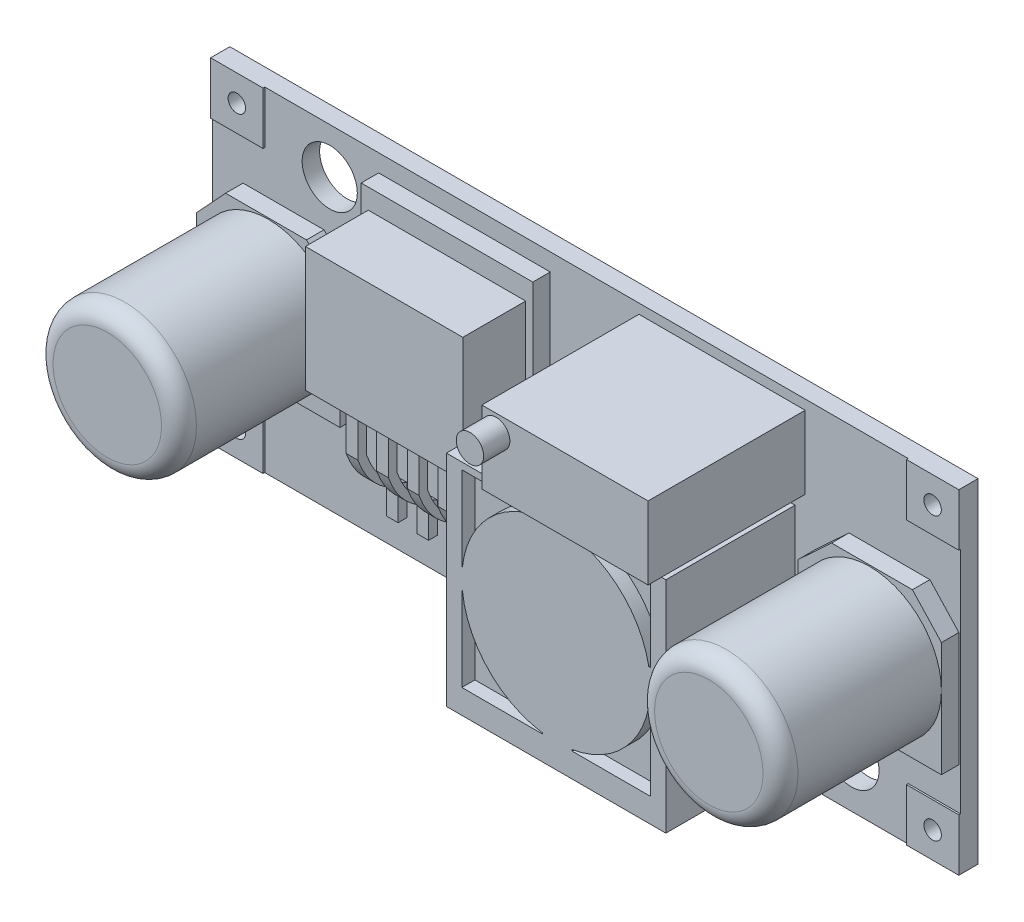
from build123d import *

# Parameters (mm, degrees)
SKETCH1_W           = 42.852737666
SKETCH1_H           = 19.127379028
SKETCH1_R           = 1.58
BOSS_EXTRUDE1_DEPTH = 1
SKETCH2_W           = 3
SKETCH2_H           = 3
BOSS_EXTRUDE2_DEPTH = 0.1
SKETCH3_R           = 0.5
CUT_EXTRUDE1_DEPTH  = 5
BOSS_EXTRUDE3_DEPTH = 1
SKETCH5_R           = 4.105
BOSS_EXTRUDE4_DEPTH = 9.22
FILLET1_R           = 1
FILLET2_R           = 1
SKETCH6_W           = 9.83
SKETCH6_H           = 8.75
BOSS_EXTRUDE5_DEPTH = 4.6
SKETCH7_W           = 9.83
SKETCH7_H           = 8.75
SKETCH7_W_2         = 9.014866003
SKETCH7_H_2         = 7.13033049
CUT_EXTRUDE2_DEPTH  = 3.6
SKETCH8_W           = 0.671327252
SKETCH8_H           = 3.75
BOSS_EXTRUDE6_DEPTH = 8
CUT_EXTRUDE3_DEPTH  = 9
SKETCH10_W          = 12.57
SKETCH10_H          = 12.57
BOSS_EXTRUDE7_DEPTH = 7.4
CUT_EXTRUDE7_DEPTH  = 0.75
SKETCH13_W          = 9.52
SKETCH13_H          = 4.17
BOSS_EXTRUDE8_DEPTH = 9
SKETCH14_R          = 0.785768403
BOSS_EXTRUDE9_DEPTH = 1.5


with BuildPart() as part:
    # Sketch1 → Boss-Extrude1 (new body)
    with BuildSketch(Plane.XY):
        Rectangle(SKETCH1_W, SKETCH1_H)
        with Locations((-14.706368833, 6.953689514)):
            Circle(SKETCH1_R, mode=Mode.SUBTRACT)
        with Locations((15.176368833, -6.773993326)):
            Circle(SKETCH1_R, mode=Mode.SUBTRACT)
    extrude(amount=BOSS_EXTRUDE1_DEPTH)

    # Sketch2 → Boss-Extrude2 (add)
    with BuildSketch(Plane.XY.offset(1)):
        with Locations((-19.926368833, 8.063689514)):
            Rectangle(SKETCH2_W, SKETCH2_H)
        with Locations((-19.926368833, -8.063689514)):
            Rectangle(SKETCH2_W, SKETCH2_H)
        with Locations((19.926368833, -8.063689514)):
            Rectangle(SKETCH2_W, SKETCH2_H)
        with Locations((19.926368833, 8.063689514)):
            Rectangle(SKETCH2_W, SKETCH2_H)
    extrude(amount=BOSS_EXTRUDE2_DEPTH)

    # Sketch3 → Cut-Extrude1 (cut)
    with BuildSketch(Plane.XY.offset(1.1)):
        with Locations((-19.926368833, 8.063689514)):
            Circle(SKETCH3_R)
        with Locations((-19.926368833, -8.063689514)):
            Circle(SKETCH3_R)
        with Locations((19.926368833, -8.063689514)):
            Circle(SKETCH3_R)
        with Locations((19.926368833, 8.063689514)):
            Circle(SKETCH3_R)
    extrude(amount=-CUT_EXTRUDE1_DEPTH, mode=Mode.SUBTRACT)

    # Sketch4 → Boss-Extrude3 (add)
    with BuildSketch(Plane.XY.offset(1)):
        Polygon((-15.037755442, 4.175), (-13.121368833, 2.397984661), (-13.121368833, -4.175), (-21.331368833, -4.175), (-21.331368833, 2.383236744), (-19.66991348, 4.175), align=None)
        Polygon((21.331368833, -4.175), (21.331368833, 2.383236744), (19.66991348, 4.175), (15.037755442, 4.175), (13.121368833, 2.397984661), (13.121368833, -4.175), align=None)
    extrude(amount=BOSS_EXTRUDE3_DEPTH)

    # Sketch5 → Boss-Extrude4 (add)
    with BuildSketch(Plane.XY.offset(2)):
        with Locations((-17.226368833, 0)):
            Circle(SKETCH5_R)
        with Locations(Location((17.226368833, 0, 0), (0, 0, 180))):
            Circle(SKETCH5_R)
    extrude(amount=BOSS_EXTRUDE4_DEPTH)

    # Fillet1
    fillet1_edges = [part.edges().sort_by_distance(p)[0] for p in [
        (-21.331368833, 0, 11.22),
    ]]
    fillet(fillet1_edges, radius=FILLET1_R)

    # Fillet2
    fillet2_edges = [part.edges().sort_by_distance(p)[0] for p in [
        (21.331368833, 0, 11.22),
    ]]
    fillet(fillet2_edges, radius=FILLET2_R)

    # Sketch6 → Boss-Extrude5 (add)
    with BuildSketch(Plane.XY.offset(1)):
        with Locations((-6.991368833, 4.188689514)):
            Rectangle(SKETCH6_W, SKETCH6_H)
    extrude(amount=BOSS_EXTRUDE5_DEPTH)

    # Sketch7 → Cut-Extrude2 (cut)
    with BuildSketch(Plane.XY.offset(5.6)):
        with Locations((-6.991368833, 4.188689514)):
            Rectangle(SKETCH7_W, SKETCH7_H)
        with Locations((-6.991368834, 3.853025888)):
            Rectangle(SKETCH7_W_2, SKETCH7_H_2, mode=Mode.SUBTRACT)
    extrude(amount=-CUT_EXTRUDE2_DEPTH, mode=Mode.SUBTRACT)

    # Sketch8 → Boss-Extrude6 (add)
    with BuildSketch(Plane(origin=(0, 0.287860643, 0), x_dir=(-1, 0, 0), z_dir=(0, -1, 0))):
        with Locations((8.85699558, -2.895840935)):
            Rectangle(SKETCH8_W, SKETCH8_H)
        with Locations((10.60699558, -2.895840935)):
            Rectangle(SKETCH8_W, SKETCH8_H)
        with Locations((7.10699558, -2.895840935)):
            Rectangle(SKETCH8_W, SKETCH8_H)
        with Locations((5.35699558, -2.895840935)):
            Rectangle(SKETCH8_W, SKETCH8_H)
        with Locations((3.60699558, -2.895840935)):
            Rectangle(SKETCH8_W, SKETCH8_H)
    extrude(amount=BOSS_EXTRUDE6_DEPTH)

    # Sketch9 → Cut-Extrude3 (cut)
    with BuildSketch(Plane(origin=(-3.271331954, 0, 0), x_dir=(0, 0, -1), z_dir=(1, 0, 0))):
        with BuildLine():
            Line((-3.820845945, -3.459233043), (-3.820845945, 0.287860643))
            Line((-3.820845945, 0.287860643), (-4.770840935, 0.287860643))
            Line((-4.770840935, 0.287860643), (-4.770840935, -7.712139357))
            Line((-4.770840935, -7.712139357), (-2, -7.712139357))
            Line((-2, -7.712139357), (-1.520840935, -7.712139357))
            Line((-1.520840935, -7.712139357), (-1.520840935, -5.954433266))
            add(Edge.make_bspline(
                [(-3.820845945, -3.459233043), (-3.201230597, -5.246051494), (-1.520840935, -5.954433266)],
                knots=[0, 0, 0, 1, 1, 1], degree=2))
        make_face()
        with BuildLine():
            Line((-2, 0.287860643), (-3.320845945, 0.287860643))
            Line((-3.320845945, 0.287860643), (-3.320845945, -3.459233043))
            add(Edge.make_bspline(
                [(-3.320845945, -3.459233043), (-2.701230597, -5.246051494), (-1.020840935, -5.954433266)],
                knots=[0, 0, 0, 1, 1, 1], degree=2))
            Line((-1.020840935, -5.954433266), (-1.020840935, -0.186310486))
            Line((-1.020840935, -0.186310486), (-2, -0.186310486))
            Line((-2, -0.186310486), (-2, 0.287860643))
        make_face()
    extrude(amount=-CUT_EXTRUDE3_DEPTH, mode=Mode.SUBTRACT)

    # Sketch10 → Boss-Extrude7 (add)
    with BuildSketch(Plane.XY.offset(1)):
        with Locations((5.661368833, -2.278689514)):
            Rectangle(SKETCH10_W, SKETCH10_H)
    extrude(amount=BOSS_EXTRUDE7_DEPTH)

    # Sketch11 → Cut-Extrude7 (cut)
    with BuildSketch(Plane.XY.offset(8.4)):
        with BuildLine():
            Line((0.261368833, -1.168201078), (0.29215187, -1.202921155))
            ThreePointArc((0.29215187, -1.202921155), (1.796004083, 1.992113497), (4.952819072, 3.574623221))
            Line((4.952819072, 3.574623221), (4.952819072, 3.621310486))
            Line((4.952819072, 3.621310486), (0.261368833, 3.621310486))
            Line((0.261368833, 3.621310486), (0.261368833, -1.168201078))
        make_face()
        with BuildLine():
            Line((0.261368833, -2.339421454), (0.29215187, -2.354457873))
            ThreePointArc((0.29215187, -2.354457873), (1.77039453, -5.523061153), (4.879917239, -7.121847139))
            Line((4.879917239, -7.121847139), (4.879917239, -7.178689514))
            Line((4.879917239, -7.178689514), (0.261368833, -7.178689514))
            Line((0.261368833, -7.178689514), (0.261368833, -2.339421454))
        make_face()
        with BuildLine():
            Line((11.061368833, -7.178689514), (11.061368833, -2.769135856))
            Line((11.061368833, -2.769135856), (10.969759931, -2.769135856))
            ThreePointArc((10.969759931, -2.769135856), (9.454565933, -5.622080694), (6.581950193, -7.099641493))
            Line((6.581950193, -7.099641493), (6.581950193, -7.178689514))
            Line((6.581950193, -7.178689514), (11.061368833, -7.178689514))
        make_face()
        with BuildLine():
            Line((6.280607425, 3.621310486), (6.280607425, 3.585687763))
            ThreePointArc((6.280607425, 3.585687763), (9.344711933, 2.170105696), (10.969759931, -0.788243173))
            Line((10.969759931, -0.788243173), (11.061368833, -0.788243173))
            Line((11.061368833, -0.788243173), (11.061368833, 3.621310486))
            Line((11.061368833, 3.621310486), (6.280607425, 3.621310486))
        make_face()
    extrude(amount=-CUT_EXTRUDE7_DEPTH, mode=Mode.SUBTRACT)

    # Sketch13 → Boss-Extrude8 (add)
    with BuildSketch(Plane.XY.offset(1)):
        with Locations((7.766965878, 6.922076652)):
            Rectangle(SKETCH13_W, SKETCH13_H)
    extrude(amount=BOSS_EXTRUDE8_DEPTH)

    # Sketch14 → Boss-Extrude9 (add)
    with BuildSketch(Plane.XY.offset(10)):
        with Locations((3.826540336, 8.02238566)):
            Circle(SKETCH14_R)
    extrude(amount=BOSS_EXTRUDE9_DEPTH)


solid = part.part
